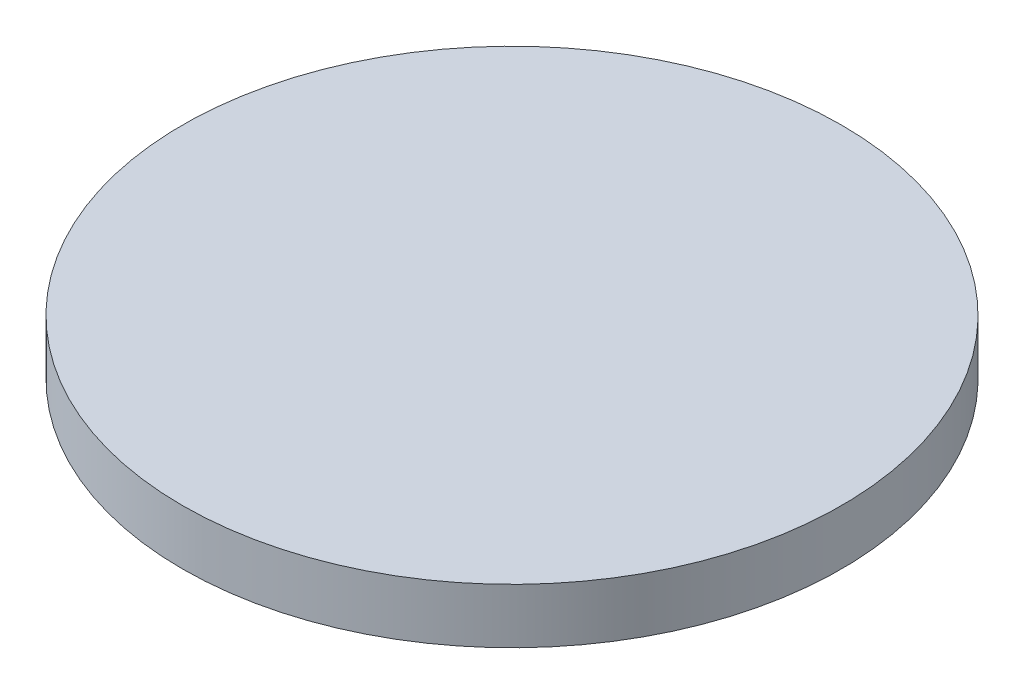
from build123d import *

# Parameters (mm, degrees)
SKETCH1_R           = 30
BOSS_EXTRUDE1_DEPTH = 2.5


with BuildPart() as part:
    # Sketch1 → Boss-Extrude1 (new, symmetric)
    with BuildSketch(Plane(origin=(0, 0, 0), x_dir=(1, 0, 0), z_dir=(0, 1, 0))):
        with Locations(Location((0, 0, 0), (0, 0, 270))):
            Circle(SKETCH1_R)
    extrude(amount=BOSS_EXTRUDE1_DEPTH, both=True)


solid = part.part
